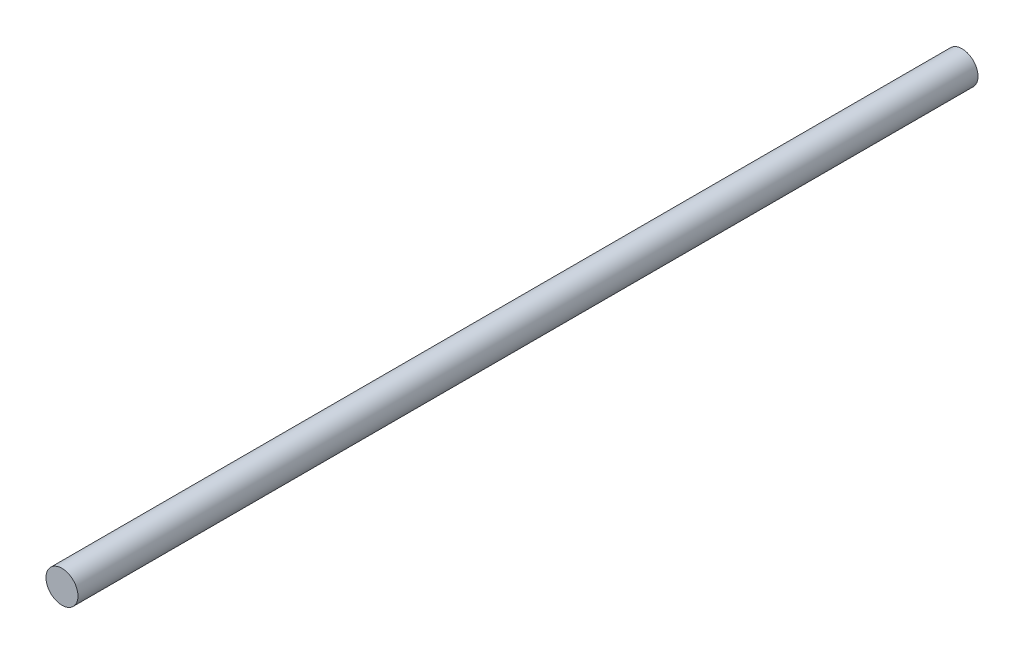
from build123d import *

# Parameters (mm, degrees)
SKETCH1_R           = 4
BOSS_EXTRUDE1_DEPTH = 112.5


with BuildPart() as part:
    # Sketch1 → Boss-Extrude1 (new, symmetric)
    with BuildSketch(Plane.XY):
        Circle(SKETCH1_R)
    extrude(amount=BOSS_EXTRUDE1_DEPTH, both=True)


solid = part.part
